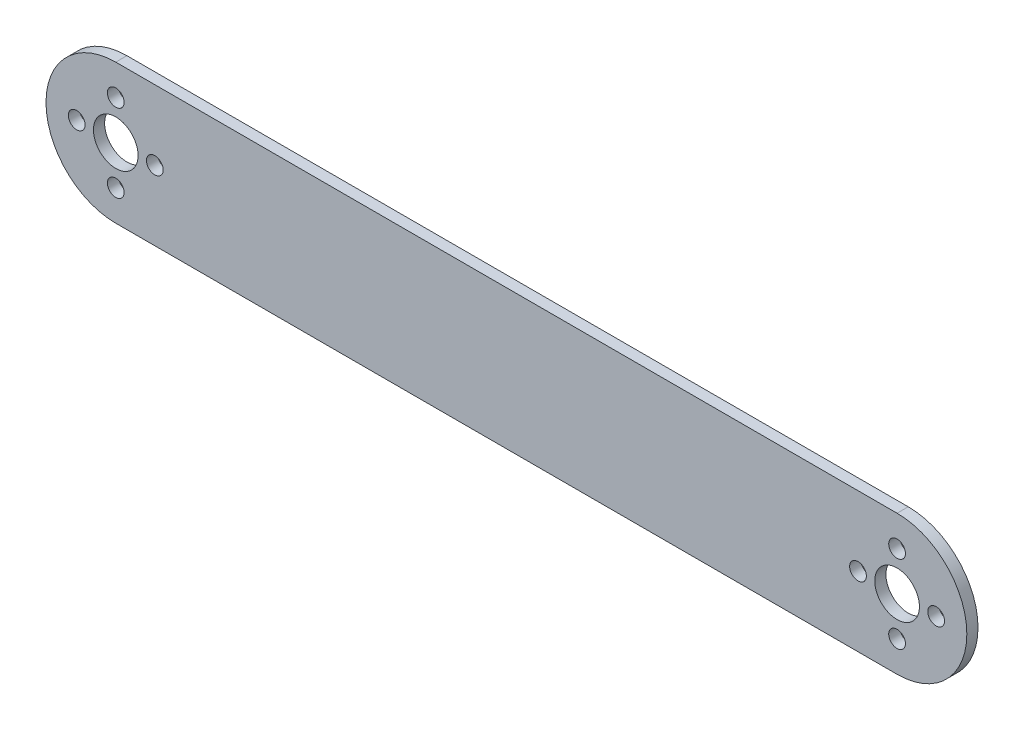
from build123d import *

# Parameters (mm, degrees)
SKETCH_1_R      = 4
SKETCH_1_R_2    = 1.5
EXTRUDE_1_DEPTH = 2


with BuildPart() as part:
    # 草图1 → 凸台-拉伸1 (new body)
    with BuildSketch(Plane.XY):
        with BuildLine():
            Line((-125, -12.5), (15, -12.5))
            ThreePointArc((15, -12.5), (27.5, 0), (15, 12.5))
            Line((15, 12.5), (-125, 12.5))
            ThreePointArc((-125, 12.5), (-137.5, 0), (-125, -12.5))
        make_face()
        with Locations((15, 0)):
            Circle(SKETCH_1_R, mode=Mode.SUBTRACT)
        with Locations((-125, 0)):
            Circle(SKETCH_1_R, mode=Mode.SUBTRACT)
        with Locations((-125, 7)):
            Circle(SKETCH_1_R_2, mode=Mode.SUBTRACT)
        with Locations((15, 7)):
            Circle(SKETCH_1_R_2, mode=Mode.SUBTRACT)
        with Locations((-118, 0)):
            Circle(SKETCH_1_R_2, mode=Mode.SUBTRACT)
        with Locations((-125, -7)):
            Circle(SKETCH_1_R_2, mode=Mode.SUBTRACT)
        with Locations((-132, 0)):
            Circle(SKETCH_1_R_2, mode=Mode.SUBTRACT)
        with Locations((22, 0)):
            Circle(SKETCH_1_R_2, mode=Mode.SUBTRACT)
        with Locations((15, -7)):
            Circle(SKETCH_1_R_2, mode=Mode.SUBTRACT)
        with Locations((8, 0)):
            Circle(SKETCH_1_R_2, mode=Mode.SUBTRACT)
    extrude(amount=EXTRUDE_1_DEPTH)


solid = part.part
